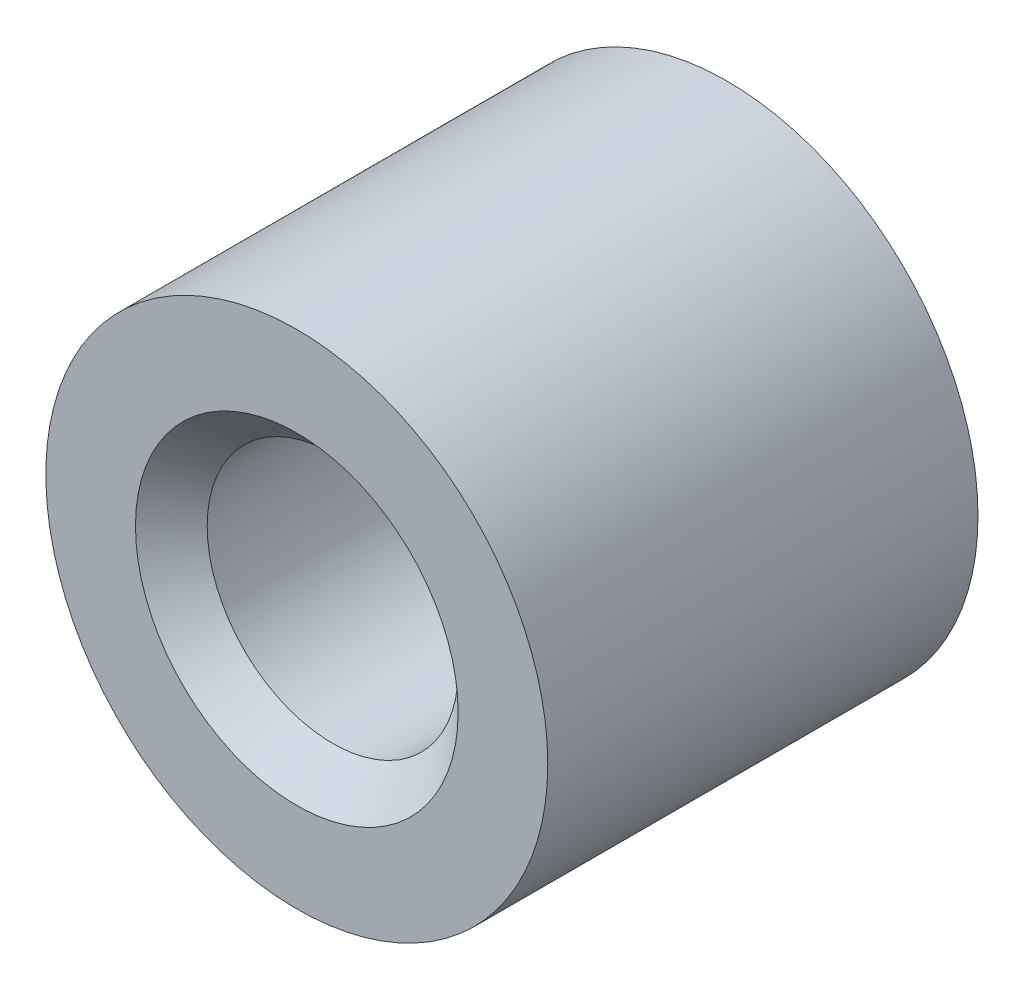
from build123d import *

# Parameters (mm, degrees)
SKETCH_1_R          = 3.5
EXTRUDE_1_DEPTH     = 6
SKETCH_2_R          = 1.75
CUT_EXTRUDE_1_DEPTH = 6
CHAMFER_1_SIZE      = 0.5


with BuildPart() as part:
    # Эскиз1 → Бобышка-Вытянуть1 (new body)
    with BuildSketch(Plane.XY):
        Circle(SKETCH_1_R)
    extrude(amount=EXTRUDE_1_DEPTH)

    # Эскиз2 → Вырез-Вытянуть1 (cut)
    with BuildSketch(Plane.XY.offset(6)):
        Circle(SKETCH_2_R)
    extrude(amount=-CUT_EXTRUDE_1_DEPTH, mode=Mode.SUBTRACT)

    # Фаска1
    chamfer_1_edges = [part.edges().sort_by_distance(p)[0] for p in [
        (-1.75, 0, 6),
    ]]
    chamfer(chamfer_1_edges, length=CHAMFER_1_SIZE)


solid = part.part
